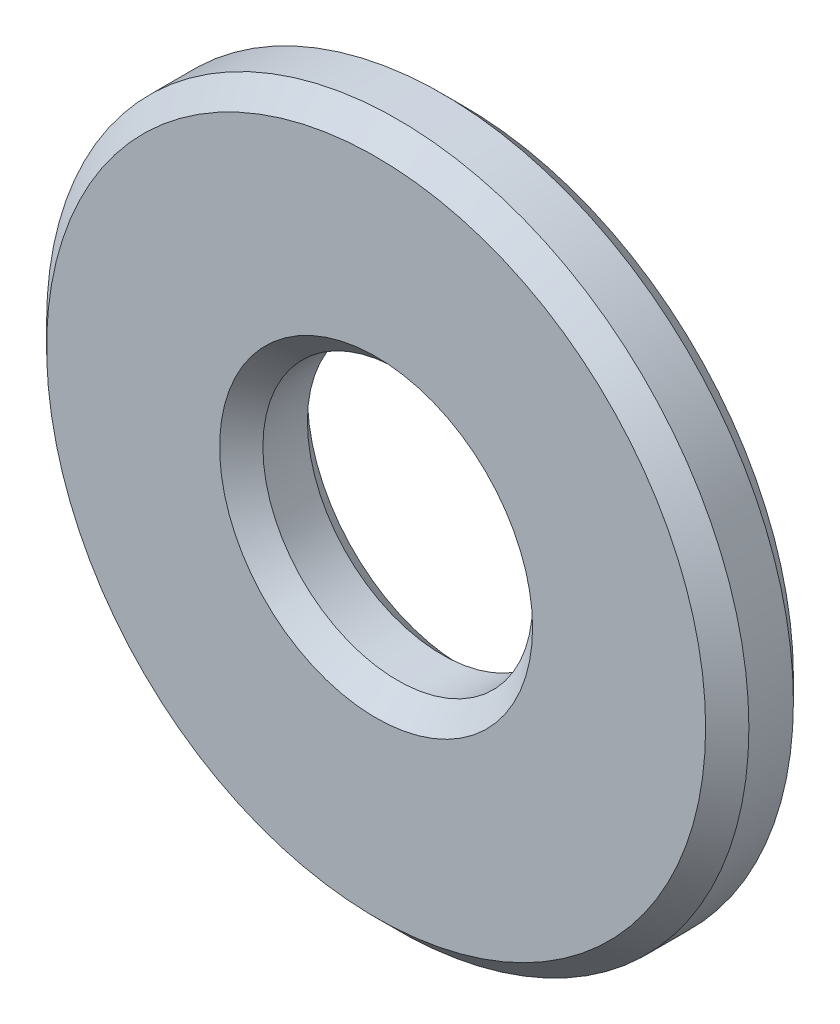
from build123d import *

# Parameters (mm, degrees)
BOSS_EXTRUDE1_DEPTH      = 0.79375
BOSS_EXTRUDE1_DEPTH_BACK = 0.79375
SKETCH3_R                = 6.35
SKETCH3_R_2              = 2.4384
CHAMFER1_SIZE            = 0.39116


with BuildPart() as part:
    # Sketch3 → Boss-Extrude1 (new, two sides: drawn at the far end of the back side and taken through both)
    with BuildSketch(Plane.XY.offset(-BOSS_EXTRUDE1_DEPTH_BACK)):
        Circle(SKETCH3_R)
        Circle(SKETCH3_R_2, mode=Mode.SUBTRACT)
    extrude(amount=BOSS_EXTRUDE1_DEPTH + BOSS_EXTRUDE1_DEPTH_BACK)

    # Chamfer1
    chamfer1_edges = [part.edges().sort_by_distance(p)[0] for p in [
        (-6.35, 0, -0.79375),
        (-2.4384, 0, -0.79375),
        (-6.35, 0, 0.79375),
        (-2.4384, 0, 0.79375),
    ]]
    chamfer(chamfer1_edges, length=CHAMFER1_SIZE)


solid = part.part
